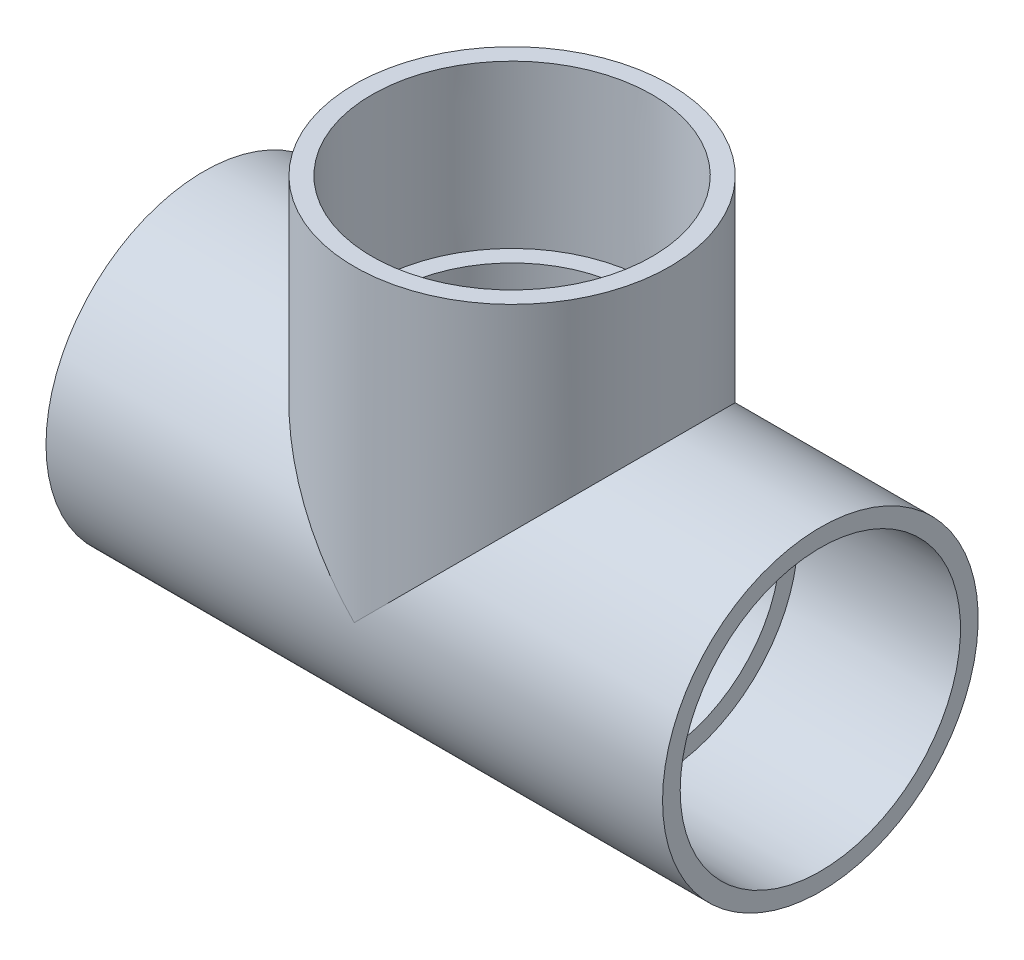
from build123d import *
from build123d.topology import SkipClean

# Parameters (mm, degrees)
BOSS_EXTRUDE1_START     = 63.5
BOSS_EXTRUDE1_DEPTH     = 63.5
BOSS_EXTRUDE2_REACH     = 101.754
SKETCH5_R               = 26.2509
CUT_EXTRUDE1_DEPTH      = 63.5
CUT_EXTRUDE2_REACH      = 101.754
CUT_EXTRUDE2_END_RADIUS = 26.2509
SKETCH6_R               = 26.2509


with BuildPart() as part:
    # Sketch1 → Revolve1 (revolve)
    with BuildSketch(Plane.XY, mode=Mode.PRIVATE) as revolve1_sk:
        Polygon((-66.675, -34.13125), (-31.75, -34.13125), (-31.75, -30.0863), (-66.675, -30.3149), align=None)
    revolve(revolve1_sk.sketch.rotate(Axis((-66.675, 0, 0), (1, 0, 0)), 270), axis=Axis((-66.675, 0, 0), (1, 0, 0)))


with BuildPart() as body_2:
    # Mirror1: mirrored copy
    add(part.part.mirror(Plane(origin=(0, 0, 0), x_dir=(0, 0, 1), z_dir=(1, 0, 0))))


with BuildPart() as body_3:
    # Sketch2 → Revolve2 (revolve)
    with BuildSketch(Plane.XY, mode=Mode.PRIVATE) as revolve2_sk:
        Polygon((30.3149, 66.675), (30.0863, 31.75), (34.13125, 31.75), (34.13125, 66.675), align=None)
    revolve(revolve2_sk.sketch.rotate(Axis((0, 0, 0), (0, 1, 0)), 90), axis=Axis((0, 0, 0), (0, 1, 0)))


with BuildPart() as part_1:
    with SkipClean():  # the faces are left unmerged after this step: merging them gives an invalid solid
        add(part.part)

        add(body_2.part)  # Boss-Extrude1 merges body 2

        add(body_3.part)  # Boss-Extrude1 merges body 3
        # Sketch3 → Boss-Extrude1 (add)
        with BuildSketch(Plane(origin=(-31.75, 0, 0), x_dir=(0, 0, -1), z_dir=(1, 0, 0)).offset(BOSS_EXTRUDE1_START)):
            with BuildLine():
                Line((12.525164, 31.75), (-12.525164, 31.75))
                ThreePointArc((-12.525164, 31.75), (0, -34.13125), (12.525164, 31.75))
            make_face()
        extrude(amount=-BOSS_EXTRUDE1_DEPTH)

    # Sketch4 → Boss-Extrude2 (add, up to next)
    with BuildSketch(Plane.XZ.offset(-31.75), mode=Mode.PRIVATE) as boss_extrude2_sk1:
        with BuildLine():
            Line((31.75, -12.525164), (31.75, 12.525164))
            ThreePointArc((31.75, 12.525164), (0, 34.13125), (-31.75, 12.525164))
            Line((-31.75, 12.525164), (-31.75, -12.525164))
            ThreePointArc((-31.75, -12.525164), (0, -34.13125), (31.75, -12.525164))
        make_face()
    boss_extrude2_tool1 = extrude(boss_extrude2_sk1.sketch, amount=BOSS_EXTRUDE2_REACH, mode=Mode.PRIVATE) - part_1.part
    add(boss_extrude2_tool1.solids().sort_by_distance((0, 31.75, 0))[0])
    add(boss_extrude2_tool1.solids().sort_by_distance((0, 31.75, 0))[1])

    # Sketch5 → Cut-Extrude1 (cut)
    with SkipClean():  # the faces are left unmerged after this step: merging them gives an invalid solid
        with BuildSketch(Plane.ZY.offset(31.75)):
            Circle(SKETCH5_R)
        extrude(amount=-CUT_EXTRUDE1_DEPTH, mode=Mode.SUBTRACT)

    # Cut-Extrude2: up to this cylinder (the profile starts outside it)
    with SkipClean():  # the faces are left unmerged after this step: merging them gives an invalid solid
        cut_extrude2_end = Plane(origin=(0, 0, 0), z_dir=(-1, 0, 0)) * Cylinder(CUT_EXTRUDE2_END_RADIUS, 257.0098, mode=Mode.PRIVATE)
        # Sketch6 → Cut-Extrude2 (cut, up to the surface)
        with BuildSketch(Plane(origin=(0, 31.75, 0), x_dir=(1, 0, 0), z_dir=(0, 1, 0)), mode=Mode.PRIVATE) as cut_extrude2_sk1:
            with Locations(Location((0, 0, 0), (0, 0, 270))):
                Circle(SKETCH6_R)
        cut_extrude2_tool1 = extrude(cut_extrude2_sk1.sketch, amount=-CUT_EXTRUDE2_REACH, mode=Mode.PRIVATE) - cut_extrude2_end
        add(cut_extrude2_tool1.solids().sort_by_distance((0, 31.75, 0))[0], mode=Mode.SUBTRACT)


solid = part_1.part
